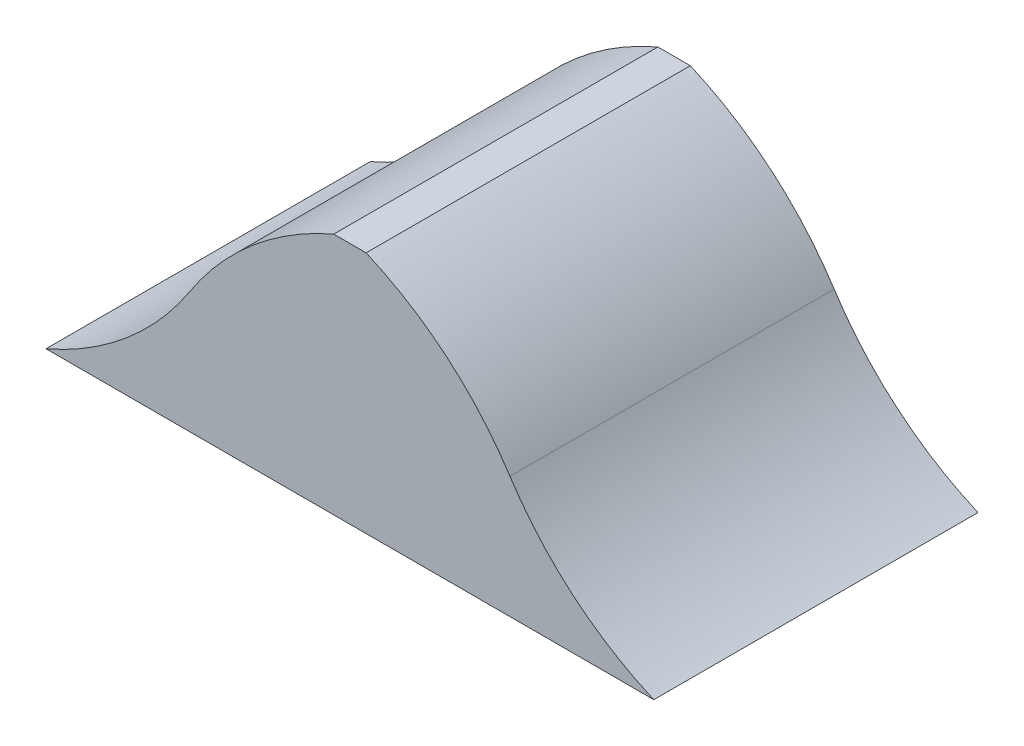
from build123d import *

# Parameters (mm, degrees)
BOSS_EXTRUDE1_DEPTH = 400


with BuildPart() as part:
    # Sketch1 → Boss-Extrude1 (new body)
    with BuildSketch(Plane.XY):
        with BuildLine():
            Line((-375, 0), (375, 0))
            ThreePointArc((375, 0), (275.116554988, 61.825423403), (197.5, 150))
            ThreePointArc((197.5, 150), (119.883445012, 238.174576597), (20, 300))
            Line((20, 300), (-20, 300))
            ThreePointArc((-20, 300), (-119.883445012, 238.174576597), (-197.5, 150))
            ThreePointArc((-197.5, 150), (-275.116554988, 61.825423403), (-375, 0))
        make_face()
    extrude(amount=BOSS_EXTRUDE1_DEPTH)


solid = part.part
